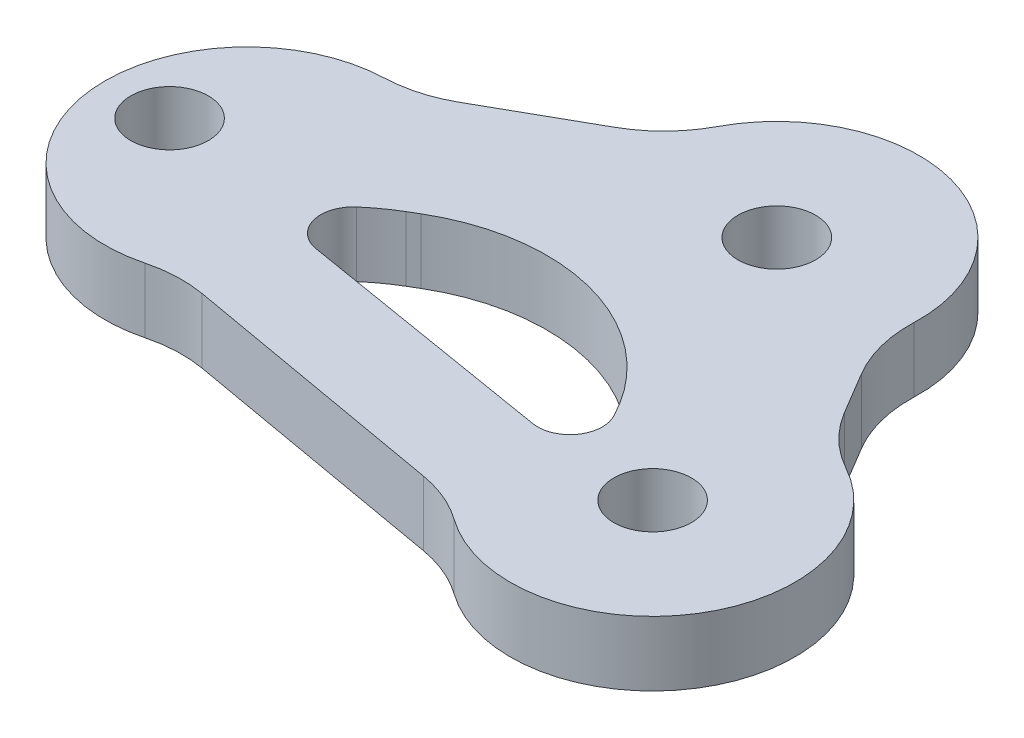
from build123d import *

# Parameters (mm, degrees)
SKETCH1_R           = 6
BOSS_EXTRUDE1_DEPTH = 10


with BuildPart() as part:
    # Sketch1 → Boss-Extrude1 (new body)
    with BuildSketch(Plane(origin=(0, 0, 0), x_dir=(1, 0, 0), z_dir=(0, 1, 0))):
        with BuildLine():
            Line((42.951232399, 3.318887452), (39.045860783, 9.872476959))
            ThreePointArc((39.045860783, 9.872476959), (36.854758208, 15.13768422), (36.238749427, 20.807240744))
            ThreePointArc((36.238749427, 20.807240744), (19.926498256, 42.82902865), (-5.191028063, 31.867342993))
            ThreePointArc((-5.191028063, 31.867342993), (-8.539203816, 27.271038576), (-13.045616394, 23.802819891))
            Line((-13.045616394, 23.802819891), (-28.400215901, 15.147576948))
            ThreePointArc((-28.400215901, 15.147576948), (-32.789279464, 13.321988508), (-37.485200727, 12.583763884))
            ThreePointArc((-37.485200727, 12.583763884), (-58.444412115, -12.582400357), (-31.160339611, -30.698794925))
            ThreePointArc((-31.160339611, -30.698794925), (-26.9348971, -30.075669304), (-22.673496589, -30.363967139))
            Line((-22.673496589, -30.363967139), (18.895945155, -37.693778855))
            ThreePointArc((18.895945155, -37.693778855), (23.162809039, -38.948266928), (27.046941071, -41.114689344))
            ThreePointArc((27.046941071, -41.114689344), (58.445846615, -34.941068913), (50.465944263, -3.951941513))
            ThreePointArc((50.465944263, -3.951941513), (46.22501506, -0.816320632), (42.951232399, 3.318887452))
        make_face()
        with Locations(Location((-48.675608258, -9.401334707, 0), (0, 0, 270))):
            Circle(SKETCH1_R, mode=Mode.SUBTRACT)
        with Locations(Location((14.252094878, 21.573414185, 0), (0, 0, 270))):
            Circle(SKETCH1_R, mode=Mode.SUBTRACT)
        with Locations(Location((39.833295256, -23.211920099, 0), (0, 0, 270))):
            Circle(SKETCH1_R, mode=Mode.SUBTRACT)
        with BuildLine():
            Line((20.312704962, -22.212607301), (-19.891412958, -15.548077687))
            ThreePointArc((-19.891412958, -15.548077687), (-23.883928025, -11.979955979), (-22.359792068, -6.846859578))
            ThreePointArc((-22.359792068, -6.846859578), (-20.208737863, -5.13808357), (-17.910389919, -3.633242594))
            Line((-17.910389919, -3.633242594), (-16.434238636, -2.760580859))
            ThreePointArc((-16.434238636, -2.760580859), (7.233462597, 0.214394926), (25.58991918, -15.018827461))
            ThreePointArc((25.58991918, -15.018827461), (25.161933747, -20.2373856), (20.312704962, -22.212607301))
        make_face(mode=Mode.SUBTRACT)
    extrude(amount=BOSS_EXTRUDE1_DEPTH)


solid = part.part
